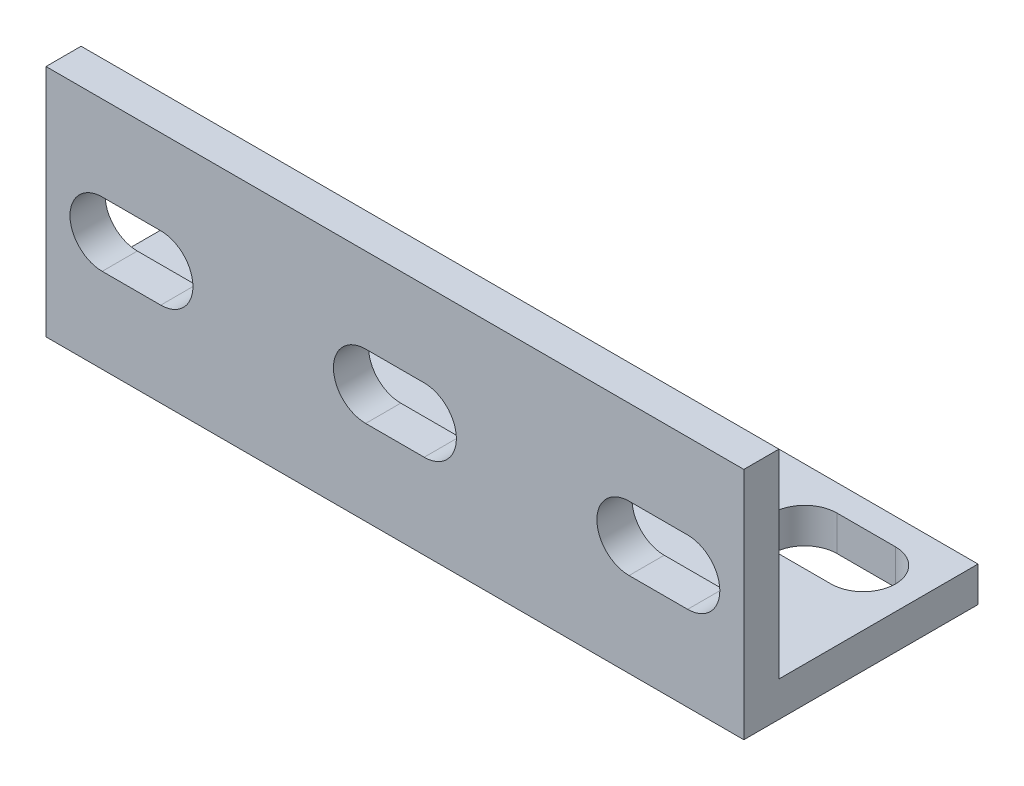
from build123d import *

# Parameters (mm, degrees)
BOSS_EXTRUDE1_DEPTH = 59.6
CUT_EXTRUDE1_DEPTH  = 66.124189054
LPATTERN1_COUNT     = 2
LPATTERN1_PITCH     = 22.5
LPATTERN1_COL_COUNT = 2
LPATTERN1_COL_PITCH = 22.5
CUT_EXTRUDE2_DEPTH  = 66.124189054
LPATTERN2_COUNT     = 2
LPATTERN2_PITCH     = 22.5
LPATTERN2_COL_COUNT = 2
LPATTERN2_COL_PITCH = 22.5


with BuildPart() as part:
    # Sketch1 → Boss-Extrude1 (new body)
    with BuildSketch(Plane(origin=(0, 0, 0), x_dir=(0, 0, -1), z_dir=(1, 0, 0))):
        Polygon((0, 20), (0, 0), (20, 0), (20, 3), (3, 3), (3, 20), align=None)
    extrude(amount=-BOSS_EXTRUDE1_DEPTH)

    # Sketch2 → Cut-Extrude1 (cut, through all)
    with BuildSketch(Plane(origin=(0, 0, -3), x_dir=(-1, 0, 0), z_dir=(0, 0, -1))):
        with BuildLine():
            Line((27.3, 12.75), (32.3, 12.75))
            ThreePointArc((32.3, 12.75), (35.05, 10), (32.3, 7.25))
            Line((32.3, 7.25), (27.3, 7.25))
            ThreePointArc((27.3, 7.25), (24.55, 10), (27.3, 12.75))
        make_face()
    cut_extrude1 = extrude(amount=-CUT_EXTRUDE1_DEPTH, mode=Mode.SUBTRACT)

    # LPattern1: Cut-Extrude1 ×2
    with Locations(*[(-i * LPATTERN1_PITCH, 0, 0) for i in range(1, LPATTERN1_COUNT)]):
        add(cut_extrude1, mode=Mode.SUBTRACT)

    # LPattern1 col: Cut-Extrude1 ×2
    with Locations(*[(i * LPATTERN1_COL_PITCH, 0, 0) for i in range(1, LPATTERN1_COL_COUNT)]):
        add(cut_extrude1, mode=Mode.SUBTRACT)

    # Sketch3 → Cut-Extrude2 (cut, through all)
    with BuildSketch(Plane(origin=(0, 3, 0), x_dir=(1, 0, 0), z_dir=(0, 1, 0))):
        with BuildLine():
            Line((-27.3, 12.25), (-32.3, 12.25))
            ThreePointArc((-32.3, 12.25), (-35.05, 15), (-32.3, 17.75))
            Line((-32.3, 17.75), (-27.3, 17.75))
            ThreePointArc((-27.3, 17.75), (-24.55, 15), (-27.3, 12.25))
        make_face()
    cut_extrude2 = extrude(amount=-CUT_EXTRUDE2_DEPTH, mode=Mode.SUBTRACT)

    # LPattern2: Cut-Extrude2 ×2
    with Locations(*[(-i * LPATTERN2_PITCH, 0, 0) for i in range(1, LPATTERN2_COUNT)]):
        add(cut_extrude2, mode=Mode.SUBTRACT)

    # LPattern2 col: Cut-Extrude2 ×2
    with Locations(*[(i * LPATTERN2_COL_PITCH, 0, 0) for i in range(1, LPATTERN2_COL_COUNT)]):
        add(cut_extrude2, mode=Mode.SUBTRACT)


solid = part.part
